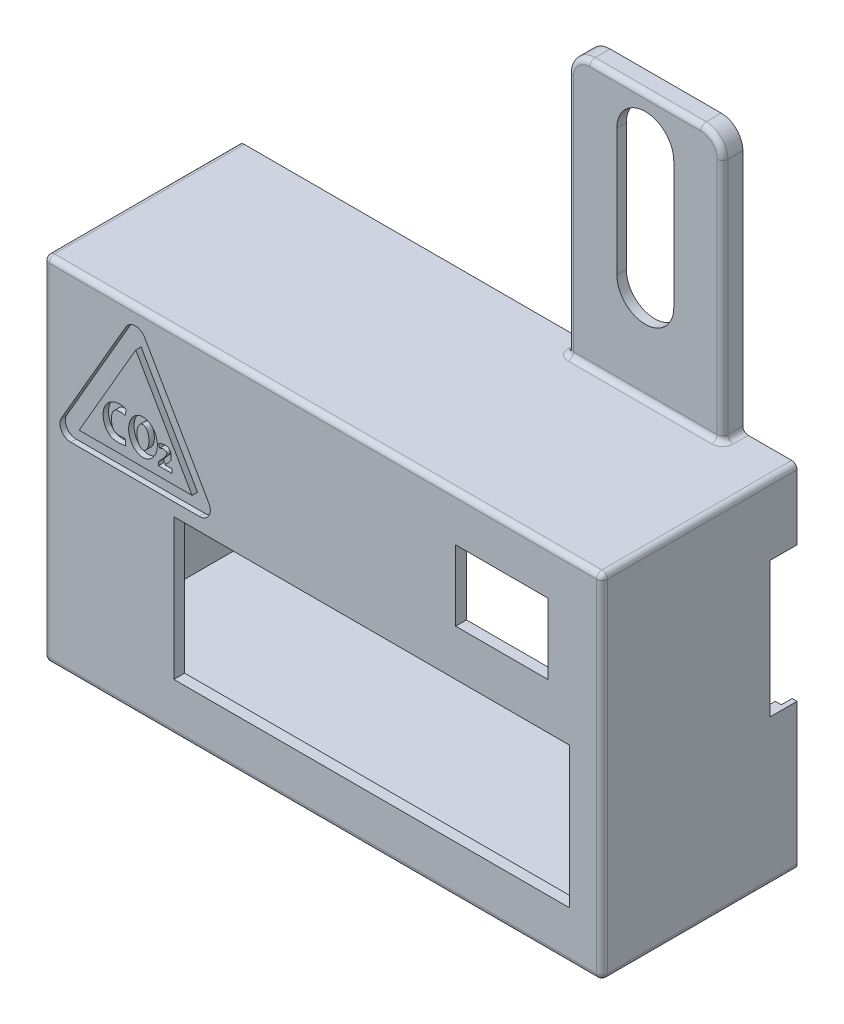
from build123d import *

# Parameters (mm, degrees)
CROQUIS1_W              = 103
CROQUIS1_H              = 65
SALIENTE_EXTRUIR2_DEPTH = 36
VACIADO7_T              = -2
CORTAR_EXTRUIR28_REACH  = 73.683
CROQUIS12_W             = 73
CROQUIS12_H             = 26
SALIENTE_EXTRUIR3_DEPTH = 3.75
CORTAR_EXTRUIR11_DEPTH  = 2
CORTAR_EXTRUIR17_REACH  = 137.001
CROQUIS16_W             = 10
CROQUIS16_H             = 12
CORTAR_EXTRUIR29_REACH  = 103.334
CROQUIS30_W             = 17
CROQUIS30_H             = 13
CROQUIS20_RX            = 3.244161213
CROQUIS20_RY            = 2.649478984
CROQUIS20_RX_2          = 2.029667585
CROQUIS20_RY_2          = 1.104878059
CORTAR_EXTRUIR24_DEPTH  = 1
CORTAR_EXTRUIR30_REACH  = 137.001
CROQUIS31_W             = 5
CROQUIS31_H             = 25
REDONDEO1_R             = 1


with BuildPart() as part:
    # Croquis1 → Saliente-Extruir2 (new body)
    with BuildSketch(Plane.XY):
        with Locations((0, -2)):
            Rectangle(CROQUIS1_W, CROQUIS1_H)
    extrude(amount=SALIENTE_EXTRUIR2_DEPTH)

    # Vaciado7
    vaciado7_openings = [part.faces().sort_by_distance(p)[0] for p in [
        (0, -2, 0),
    ]]
    offset(amount=VACIADO7_T, openings=vaciado7_openings, kind=Kind.INTERSECTION)

    # Croquis12 → Cortar-Extruir28 (cut, up to next)
    with BuildSketch(Plane.XY.offset(36), mode=Mode.PRIVATE) as cortar_extruir28_sk1:
        with Locations((9, -12.5)):
            Rectangle(CROQUIS12_W, CROQUIS12_H)
    cortar_extruir28_tool1 = extrude(cortar_extruir28_sk1.sketch, amount=-CORTAR_EXTRUIR28_REACH, mode=Mode.PRIVATE) & part.part
    add(cortar_extruir28_tool1.solids().sort_by_distance((9, -12.5, 36))[0], mode=Mode.SUBTRACT)

    # Croquis29 → Saliente-Extruir3 (add)
    with BuildSketch(Plane(origin=(0, 0, 0), x_dir=(-1, 0, 0), z_dir=(0, 0, -1))):
        with BuildLine():
            Line((-13, 75.5), (-13, 30.5))
            Line((-13, 30.5), (-41.5, 30.5))
            Line((-41.5, 30.5), (-41.5, 75.5))
            ThreePointArc((-41.5, 75.5), (-40.328427125, 78.328427125), (-37.5, 79.5))
            Line((-37.5, 79.5), (-17, 79.5))
            ThreePointArc((-17, 79.5), (-14.171572875, 78.328427125), (-13, 75.5))
        make_face()
        with BuildLine():
            Line((-22, 71.25), (-22, 47.75))
            ThreePointArc((-22, 47.75), (-27.25, 42.5), (-32.5, 47.75))
            Line((-32.5, 47.75), (-32.5, 71.25))
            ThreePointArc((-32.5, 71.25), (-27.25, 76.5), (-22, 71.25))
        make_face(mode=Mode.SUBTRACT)
    extrude(amount=-SALIENTE_EXTRUIR3_DEPTH)

    # Croquis14 → Cortar-Extruir11 (cut)
    with BuildSketch(Plane(origin=(0, 0, 0), x_dir=(-1, 0, 0), z_dir=(0, 0, -1))):
        with BuildLine():
            Line((50.6, -33.6), (50.6, 29.6))
            Line((50.6, 29.6), (-13.9, 29.6))
            Line((-13.9, 29.6), (-13.9, 75.5))
            ThreePointArc((-13.9, 75.5), (-14.807968978, 77.692031022), (-17, 78.6))
            Line((-17, 78.6), (-37.5, 78.6))
            ThreePointArc((-37.5, 78.6), (-39.692031022, 77.692031022), (-40.6, 75.5))
            Line((-40.6, 75.5), (-40.6, 29.6))
            Line((-40.6, 29.6), (-50.6, 29.6))
            Line((-50.6, 29.6), (-50.6, -33.6))
            Line((-50.6, -33.6), (50.6, -33.6))
        make_face()
    extrude(amount=-CORTAR_EXTRUIR11_DEPTH, mode=Mode.SUBTRACT)

    # Croquis16 → Cortar-Extruir17 (cut, up to next)
    with BuildSketch(Plane.ZY.offset(51.5), mode=Mode.PRIVATE) as cortar_extruir17_sk1:
        with Locations((7, -10.75)):
            Rectangle(CROQUIS16_W, CROQUIS16_H)
    cortar_extruir17_tool1 = extrude(cortar_extruir17_sk1.sketch, amount=-CORTAR_EXTRUIR17_REACH, mode=Mode.PRIVATE) & part.part
    add(cortar_extruir17_tool1.solids().sort_by_distance((-51.5, -10.75, 7))[0], mode=Mode.SUBTRACT)

    # Croquis30 → Cortar-Extruir29 (cut, up to next)
    with BuildSketch(Plane.XY.offset(36), mode=Mode.PRIVATE) as cortar_extruir29_sk1:
        with Locations((33, 15.5)):
            Rectangle(CROQUIS30_W, CROQUIS30_H)
    cortar_extruir29_tool1 = extrude(cortar_extruir29_sk1.sketch, amount=-CORTAR_EXTRUIR29_REACH, mode=Mode.PRIVATE) & part.part
    add(cortar_extruir29_tool1.solids().sort_by_distance((33, 15.5, 36))[0], mode=Mode.SUBTRACT)

    # Croquis20 → Cortar-Extruir24 (cut)
    # profile 1 of 4: a face of its own
    with BuildSketch(Plane.XY.offset(36)):
        with BuildLine():
            Line((-32.877371929, 26.422410606), (-21.038034651, 5.891314445))
            ThreePointArc((-21.038034651, 5.891314445), (-21.038818093, 3.891767038), (-22.770607635, 2.892219426))
            Line((-22.770607635, 2.892219426), (-46.505903571, 2.892219426))
            ThreePointArc((-46.505903571, 2.892219426), (-48.238726232, 3.89355751), (-48.236407571, 5.894893803))
            Line((-48.236407571, 5.894893803), (-36.340448913, 26.425989964))
            ThreePointArc((-36.340448913, 26.425989964), (-34.607877759, 27.423314519), (-32.877371929, 26.422410606))
        make_face()
        Polygon((-24.134944502, 5.589013553), (-44.975333507, 5.589013553), (-34.530281265, 23.61600727), align=None, mode=Mode.SUBTRACT)
    # profile 2 of 4: a face of its own
    with BuildSketch(Plane.XY.offset(36)):
        with BuildLine():
            add(Edge.make_bspline(
                [(-36.492042346, 12.163564203), (-36.721798149, 12.216584773), (-36.946159791, 12.305207397), (-37.181309753, 12.322625912), (-37.428691713, 12.340950502), (-37.677714014, 12.302389838), (-37.92359773, 12.269605343), (-39.211705056, 12.097857699), (-39.130223403, 10.008481597), (-38.824947416, 9.194412297), (-38.471289709, 8.251325078), (-37.239201594, 8.380618349), (-36.492042346, 8.50514489)],
                knots=[0, 0, 0, 0, 1, 1, 1, 2, 2, 2, 3, 3, 3, 4, 4, 4, 4], degree=3))
            Line((-36.492042346, 8.50514489), (-36.386001207, 7.338692355))
            add(Edge.make_bspline(
                [(-36.386001207, 7.338692355), (-37.455699366, 7.204980085), (-38.280952684, 7.103931885), (-39.249111974, 7.550774634), (-39.294499295, 7.571722629), (-39.319806067, 7.621468727), (-39.355153113, 7.656815774), (-39.704014417, 8.005677078), (-40.006289411, 8.220522758), (-40.203482229, 8.664206599), (-40.972994564, 10.395609351), (-40.466643717, 12.540322436), (-38.665885706, 13.276996168), (-37.884767663, 13.596544459), (-37.05562877, 13.587263649), (-36.279960067, 13.276996168)],
                knots=[0, 0, 0, 0, 1, 1, 1, 2, 2, 2, 3, 3, 3, 4, 4, 4, 5, 5, 5, 5], degree=3))
            Line((-36.279960067, 13.276996168), (-36.492042346, 12.163564203))
        make_face()
    # profile 3 of 4: a face of its own
    with BuildSketch(Plane.XY.offset(36)):
        with Locations(Location((-33.188828288, 10.362256285), (0, 0, -90.640192277))):
            Ellipse(CROQUIS20_RX, CROQUIS20_RY)
        with Locations(Location((-33.20228715, 10.364336342), (0, 0, -89.299840613))):
            Ellipse(CROQUIS20_RX_2, CROQUIS20_RY_2, mode=Mode.SUBTRACT)
    # profile 4 of 4: a face of its own
    with BuildSketch(Plane.XY.offset(36)):
        with BuildLine():
            add(Edge.make_bspline(
                [(-30.341656255, 7.232651216), (-30.323982731, 7.462407018), (-30.379408301, 7.710115851), (-30.288635685, 7.921918623), (-30.185338507, 8.162945371), (-27.605603956, 10.360864831), (-29.440306569, 10.360864831), (-29.809630445, 10.360864831), (-29.823242351, 10.225365458), (-30.129573976, 10.148782552)],
                knots=[0, 0, 0, 0, 1, 1, 1, 2, 2, 2, 3, 3, 3, 3], degree=3))
            Line((-30.129573976, 10.148782552), (-30.341656255, 10.785029389))
            add(Edge.make_bspline(
                [(-30.341656255, 10.785029389), (-28.897370629, 11.507172202), (-27.775654694, 11.154718258), (-28.008751185, 9.406494576), (-28.069313134, 8.952279958), (-28.865628872, 8.254816587), (-29.12218315, 7.974939192)],
                knots=[0, 0, 0, 0, 1, 1, 1, 2, 2, 2, 2], degree=3))
            Line((-29.12218315, 7.974939192), (-27.84858536, 7.974939192))
            Line((-27.84858536, 7.974939192), (-27.84858536, 7.230680553))
            Line((-27.84858536, 7.230680553), (-30.341656255, 7.232651216))
        make_face()
    extrude(amount=-CORTAR_EXTRUIR24_DEPTH, mode=Mode.SUBTRACT)

    # Croquis31 → Cortar-Extruir30 (cut, up to next)
    with BuildSketch(Plane(origin=(51.5, 0, 0), x_dir=(0, 0, -1), z_dir=(1, 0, 0)), mode=Mode.PRIVATE) as cortar_extruir30_sk1:
        with Locations((-2.5, 5)):
            Rectangle(CROQUIS31_W, CROQUIS31_H)
    cortar_extruir30_tool1 = extrude(cortar_extruir30_sk1.sketch, amount=-CORTAR_EXTRUIR30_REACH, mode=Mode.PRIVATE) & part.part
    add(cortar_extruir30_tool1.solids().sort_by_distance((51.5, 5, 2.5))[0], mode=Mode.SUBTRACT)

    # Redondeo1
    redondeo1_edges = [part.edges().sort_by_distance(p)[0] for p in [
        (51.5, -2, 36),
        (0, 30.5, 36),
        (40.328427125, 78.328427125, 3.75),
        (27.25, 79.5, 3.75),
        (14.171572875, 78.328427125, 3.75),
        (13, 53, 3.75),
        (27.25, 30.5, 3.75),
        (13, 30.5, 1.875),
        (41.5, 53, 3.75),
        (41.5, 30.5, 1.875),
        (-51.5, -2, 36),
        (-51.5, 30.5, 18),
        (51.5, 30.5, 18),
        (51.5, -34.5, 18),
        (-51.5, -34.5, 18),
        (0, -34.5, 36),
    ]]
    fillet(redondeo1_edges, radius=REDONDEO1_R)


solid = part.part
